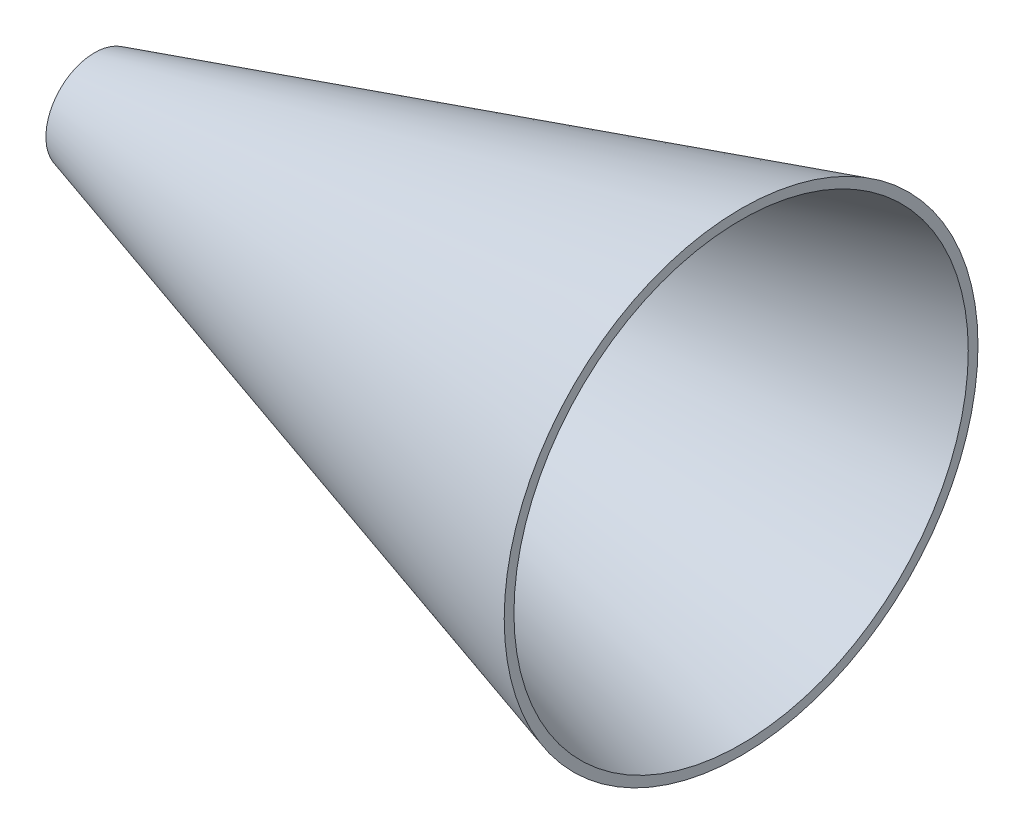
from build123d import *

# Parameters (mm, degrees)
SKETCH2_R          = 1.016
CUT_EXTRUDE1_DEPTH = 2.54


with BuildPart() as part:
    # Sketch1 → Revolve1 (revolve)
    with BuildSketch(Plane.XY):
        Polygon((0, 0), (0, 1.27), (16.891, 6.188654966), (16.891, 5.934654966), (0.254, 1.089964736), (0.254, 0), align=None)
    revolve(axis=Axis((-88.99, 0, 0), (1, 0, 0)))

    # Sketch2 → Cut-Extrude1 (cut)
    with BuildSketch(Plane.ZY):
        Circle(SKETCH2_R)
    extrude(amount=-CUT_EXTRUDE1_DEPTH, mode=Mode.SUBTRACT)


solid = part.part
